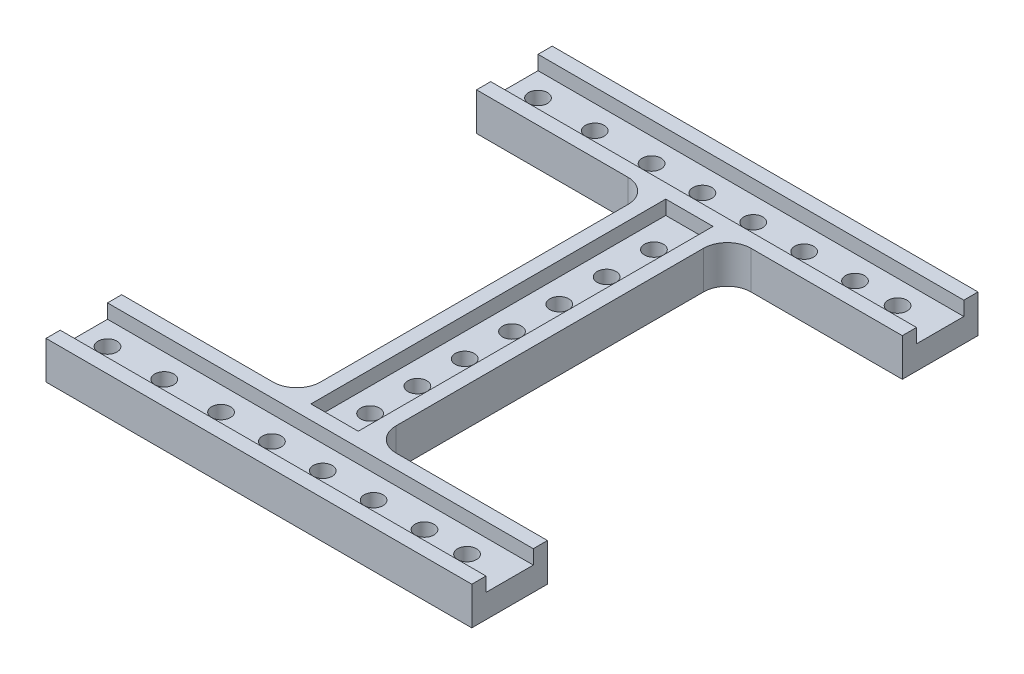
from build123d import *

# Parameters (mm, degrees)
SKETCH1_W           = 90
SKETCH1_H           = 16
BOSS_EXTRUDE1_DEPTH = 5
SKETCH2_W           = 90
SKETCH2_H           = 3
BOSS_EXTRUDE2_DEPTH = 3
SKETCH3_R           = 2
CUT_EXTRUDE2_DEPTH  = 5
SKETCH4_W           = 90
SKETCH4_H           = 16
SKETCH4_R           = 2
BOSS_EXTRUDE3_DEPTH = 5
SKETCH5_W           = 90
SKETCH5_H           = 3
BOSS_EXTRUDE4_DEPTH = 3
BOSS_EXTRUDE5_DEPTH = 5
SKETCH7_W           = 3
SKETCH7_H           = 75
BOSS_EXTRUDE6_DEPTH = 3
SKETCH8_R           = 2
CUT_EXTRUDE5_DEPTH  = 5
SKETCH9_R           = 2
CUT_EXTRUDE6_DEPTH  = 5
FILLET1_R           = 5
SKETCH10_R          = 4
CUT_EXTRUDE7_DEPTH  = 2
SKETCH11_R          = 4
CUT_EXTRUDE8_DEPTH  = 2


with BuildPart() as part:
    # Sketch1 → Boss-Extrude1 (new body)
    with BuildSketch(Plane(origin=(0, 0, 0), x_dir=(1, 0, 0), z_dir=(0, 1, 0))):
        with Locations((-6.794417438, 1.807142857)):
            Rectangle(SKETCH1_W, SKETCH1_H)
    extrude(amount=BOSS_EXTRUDE1_DEPTH)

    # Sketch2 → Boss-Extrude2 (add)
    with BuildSketch(Plane(origin=(0, 5, 0), x_dir=(1, 0, 0), z_dir=(0, 1, 0))):
        with Locations((-6.794417438, 8.307142857)):
            Rectangle(SKETCH2_W, SKETCH2_H)
        with Locations((-6.794417438, -4.692857143)):
            Rectangle(SKETCH2_W, SKETCH2_H)
    extrude(amount=BOSS_EXTRUDE2_DEPTH)

    # Sketch3 → Cut-Extrude2 (cut)
    with BuildSketch(Plane.XZ):
        with Locations(Location((20.205582562, -1.807142857, 0), (0, 0, 270))):
            Circle(SKETCH3_R)
        with Locations(Location((-22.794417438, -1.807142857, 0), (0, 0, 270))):
            Circle(SKETCH3_R)
    extrude(amount=-CUT_EXTRUDE2_DEPTH, mode=Mode.SUBTRACT)



with BuildPart() as body_2:
    # Sketch4 → Boss-Extrude3 (new body)
    with BuildSketch(Plane.XZ):
        with Locations((-6.794417438, -92.807142857)):
            Rectangle(SKETCH4_W, SKETCH4_H)
        with Locations(Location((20.205582562, -92.807142857, 0), (0, 0, 270))):
            Circle(SKETCH4_R, mode=Mode.SUBTRACT)
        with Locations(Location((-22.794417438, -92.807142857, 0), (0, 0, 270))):
            Circle(SKETCH4_R, mode=Mode.SUBTRACT)
    extrude(amount=-BOSS_EXTRUDE3_DEPTH)

    # Sketch5 → Boss-Extrude4 (add)
    with BuildSketch(Plane(origin=(0, 5, 0), x_dir=(1, 0, 0), z_dir=(0, 1, 0))):
        with Locations((-6.794417438, 99.307142857)):
            Rectangle(SKETCH5_W, SKETCH5_H)
        with Locations((-6.794417438, 86.307142857)):
            Rectangle(SKETCH5_W, SKETCH5_H)
    extrude(amount=BOSS_EXTRUDE4_DEPTH)


with BuildPart() as part_1:
    add(part.part)

    add(body_2.part)  # Boss-Extrude5 merges body 2
    # Sketch6 → Boss-Extrude5 (add)
    with BuildSketch(Plane.XZ):
        Polygon((-6.794417438, -84.807142857), (1.205582562, -84.807142857), (1.205582562, -9.807142857), (-14.794417438, -9.807142857), (-14.794417438, -84.807142857), align=None)
    extrude(amount=-BOSS_EXTRUDE5_DEPTH)

    # Sketch7 → Boss-Extrude6 (add)
    with BuildSketch(Plane(origin=(0, 5, 0), x_dir=(1, 0, 0), z_dir=(0, 1, 0))):
        with Locations((-0.294417438, 47.307142857)):
            Rectangle(SKETCH7_W, SKETCH7_H)
        with Locations((-13.294417438, 47.307142857)):
            Rectangle(SKETCH7_W, SKETCH7_H)
    extrude(amount=BOSS_EXTRUDE6_DEPTH)

    # Sketch8 → Cut-Extrude5 (cut)
    with BuildSketch(Plane(origin=(0, 5, 0), x_dir=(1, 0, 0), z_dir=(0, 1, 0))):
        with Locations(Location((-46.794417438, 92.807142857, 0), (0, 0, 270))):
            Circle(SKETCH8_R)
        with Locations(Location((-34.794417438, 92.807142857, 0), (0, 0, 270))):
            Circle(SKETCH8_R)
        with Locations(Location((29.205582562, 92.807142857, 0), (0, 0, 270))):
            Circle(SKETCH8_R)
        with Locations(Location((9.455582562, 92.807142857, 0), (0, 0, 270))):
            Circle(SKETCH8_R)
        with Locations(Location((-1.294417438, 92.807142857, 0), (0, 0, 270))):
            Circle(SKETCH8_R)
        with Locations(Location((-12.044417438, 92.807142857, 0), (0, 0, 270))):
            Circle(SKETCH8_R)
        with Locations(Location((-1.294417438, 1.807142857, 0), (0, 0, 270))):
            Circle(SKETCH8_R)
        with Locations(Location((-12.044417438, 1.807142857, 0), (0, 0, 270))):
            Circle(SKETCH8_R)
        with Locations(Location((9.455582562, 1.807142857, 0), (0, 0, 270))):
            Circle(SKETCH8_R)
        with Locations(Location((-34.794417438, 1.807142857, 0), (0, 0, 270))):
            Circle(SKETCH8_R)
        with Locations(Location((29.205582562, 1.807142857, 0), (0, 0, 270))):
            Circle(SKETCH8_R)
        with Locations(Location((-46.794417438, 1.807142857, 0), (0, 0, 270))):
            Circle(SKETCH8_R)
    extrude(amount=-CUT_EXTRUDE5_DEPTH, mode=Mode.SUBTRACT)

    # Sketch9 → Cut-Extrude6 (cut)
    with BuildSketch(Plane(origin=(0, 5, 0), x_dir=(1, 0, 0), z_dir=(0, 1, 0))):
        with Locations(Location((-6.794417438, 47.307142857, 0), (0, 0, 270))):
            Circle(SKETCH9_R)
        with Locations(Location((-6.794417438, 57.307142857, 0), (0, 0, 270))):
            Circle(SKETCH9_R)
        with Locations(Location((-6.794417438, 67.307142857, 0), (0, 0, 270))):
            Circle(SKETCH9_R)
        with Locations(Location((-6.794417438, 77.307142857, 0), (0, 0, 270))):
            Circle(SKETCH9_R)
        with Locations(Location((-6.794417438, 37.307142857, 0), (0, 0, 270))):
            Circle(SKETCH9_R)
        with Locations(Location((-6.794417438, 27.307142857, 0), (0, 0, 270))):
            Circle(SKETCH9_R)
        with Locations(Location((-6.794417438, 17.307142857, 0), (0, 0, 270))):
            Circle(SKETCH9_R)
    extrude(amount=-CUT_EXTRUDE6_DEPTH, mode=Mode.SUBTRACT)

    # Fillet1
    fillet1_edges = [part_1.edges().sort_by_distance(p)[0] for p in [
        (-14.794417438, 4, -84.807142857),
        (-14.794417438, 4, -9.807142857),
        (1.205582562, 4, -9.807142857),
        (1.205582562, 4, -84.807142857),
    ]]
    fillet(fillet1_edges, radius=FILLET1_R)

    # Sketch10 → Cut-Extrude7 (cut)
    with BuildSketch(Plane.XZ):
        with Locations(Location((20.205582562, -1.807142857, 0), (0, 0, 270))):
            Circle(SKETCH10_R)
        with Locations(Location((-22.794417438, -1.807142857, 0), (0, 0, 270))):
            Circle(SKETCH10_R)
        with Locations(Location((20.205582562, -92.807142857, 0), (0, 0, 270))):
            Circle(SKETCH10_R)
        with Locations(Location((-22.794417438, -92.807142857, 0), (0, 0, 270))):
            Circle(SKETCH10_R)
    extrude(amount=-CUT_EXTRUDE7_DEPTH, mode=Mode.SUBTRACT)

    # Sketch11 → Cut-Extrude8 (cut)
    with BuildSketch(Plane.XZ):
        with Locations(Location((-46.794417438, -1.807142857, 0), (0, 0, 270))):
            Circle(SKETCH11_R)
        with Locations(Location((-46.794417438, -92.807142857, 0), (0, 0, 270))):
            Circle(SKETCH11_R)
    extrude(amount=-CUT_EXTRUDE8_DEPTH, mode=Mode.SUBTRACT)


solid = part_1.part
